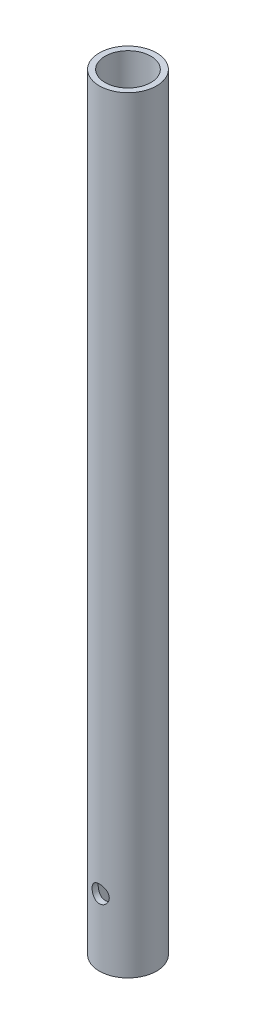
from build123d import *

# Parameters (mm, degrees)
SKETCH_1_R          = 25
SKETCH_1_R_2        = 20
EXTRUDE_1_DEPTH     = 670
SKETCH_4_R          = 7.5
CUT_EXTRUDE_3_DEPTH = 25


with BuildPart() as part:
    # 草图1 → 凸台-拉伸1 (new body)
    with BuildSketch(Plane(origin=(0, 0, 0), x_dir=(1, 0, 0), z_dir=(0, 1, 0))):
        with Locations(Location((0, 0, 0), (0, 0, 270))):
            Circle(SKETCH_1_R)
        with Locations(Location((0, 0, 0), (0, 0, 270))):
            Circle(SKETCH_1_R_2, mode=Mode.SUBTRACT)
    extrude(amount=EXTRUDE_1_DEPTH)

    # 草图4 → 切除-拉伸3 (cut, symmetric)
    with BuildSketch(Plane.XY):
        with Locations((0, 58.516476658)):
            Circle(SKETCH_4_R)
    extrude(amount=CUT_EXTRUDE_3_DEPTH, both=True, mode=Mode.SUBTRACT)


solid = part.part
